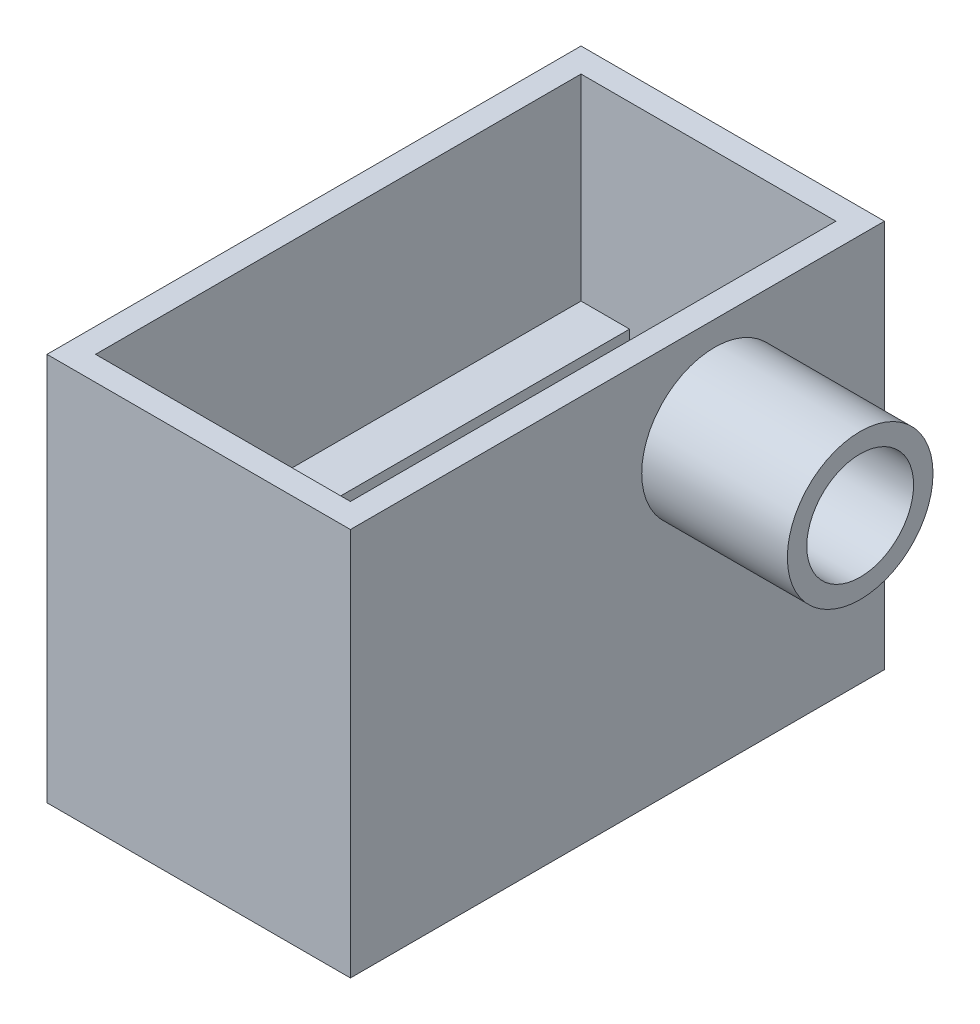
from build123d import *

# Parameters (mm, degrees)
SKETCH1_W                 = 62.5
SKETCH1_H                 = 110
BOSS_EXTRUDE1_DEPTH       = 80
SHELL1_T                  = -5
SHELL1_THICKNESS_2_FACE_W = 100
SHELL1_THICKNESS_2_FACE_H = 52.5
SHELL1_THICKNESS_2_DEPTH  = 6
SKETCH2_R                 = 15
SKETCH2_R_2               = 11
BOSS_EXTRUDE2_DEPTH       = 30
CUT_EXTRUDE2_REACH        = 117.461
BOSS_EXTRUDE3_START       = -52.5
BOSS_EXTRUDE3_DEPTH       = 10
CUT_EXTRUDE4_REACH        = 109.413
SKETCH6_R                 = 14.5
SKETCH6_3_R               = 16.002
SKETCH6_3_R_2             = 14.5
CUT_EXTRUDE5_DEPTH        = 8
SKETCH7_R                 = 4.7625
CUT_EXTRUDE6_DEPTH        = 108.413046228


with BuildPart() as part:
    # Sketch1 → Boss-Extrude1 (new body)
    with BuildSketch(Plane(origin=(0, 0, 0), x_dir=(1, 0, 0), z_dir=(0, 1, 0))):
        Rectangle(SKETCH1_W, SKETCH1_H)
    extrude(amount=BOSS_EXTRUDE1_DEPTH)

    # Shell1
    shell1_openings = [part.faces().sort_by_distance(p)[0] for p in [
        (0, 80, 0),
    ]]
    offset(amount=SHELL1_T, openings=shell1_openings, kind=Kind.INTERSECTION)

    # Shell1 thickness 2 face (on inner face of the shell) → Shell1 thickness 2 (add)
    with BuildSketch(Plane(origin=(0, 5, 0), x_dir=(0, 0, -1), z_dir=(0, -1, 0))):
        Rectangle(SHELL1_THICKNESS_2_FACE_W, SHELL1_THICKNESS_2_FACE_H)
    extrude(amount=-SHELL1_THICKNESS_2_DEPTH)

    # Sketch2 → Boss-Extrude2 (add)
    with BuildSketch(Plane(origin=(31.25, 0, 0), x_dir=(0, 0, -1), z_dir=(1, 0, 0))):
        with Locations(Location((20, 60, 0), (0, 0, 180))):
            Circle(SKETCH2_R)
        with Locations((20, 60)):
            Circle(SKETCH2_R_2, mode=Mode.SUBTRACT)
    extrude(amount=BOSS_EXTRUDE2_DEPTH)

    # Sketch2<3> → Cut-Extrude2 (cut, up to next)
    with BuildSketch(Plane(origin=(31.25, 0, 0), x_dir=(0, 0, -1), z_dir=(1, 0, 0)), mode=Mode.PRIVATE) as cut_extrude2_sk1:
        with BuildLine():
            ThreePointArc((31, 60), (27.778174593, 67.778174593), (20, 71))
            Line((20, 71), (20, 49))
            ThreePointArc((20, 49), (27.778174593, 52.221825407), (31, 60))
        make_face()
    cut_extrude2_tool1 = extrude(cut_extrude2_sk1.sketch, amount=-CUT_EXTRUDE2_REACH, mode=Mode.PRIVATE) & part.part
    # Sketch2<3> → Cut-Extrude2 (cut, up to next)
    with BuildSketch(Plane(origin=(31.25, 0, 0), x_dir=(0, 0, -1), z_dir=(1, 0, 0)), mode=Mode.PRIVATE) as cut_extrude2_sk2:
        with BuildLine():
            Line((20, 49), (20, 71))
            ThreePointArc((20, 71), (9, 60), (20, 49))
        make_face()
    cut_extrude2_tool2 = extrude(cut_extrude2_sk2.sketch, amount=-CUT_EXTRUDE2_REACH, mode=Mode.PRIVATE) & part.part
    # Sketch2<3> → Cut-Extrude2 (cut, up to next)
    with BuildSketch(Plane(origin=(31.25, 0, 0), x_dir=(0, 0, -1), z_dir=(1, 0, 0)), mode=Mode.PRIVATE) as cut_extrude2_sk3:
        with BuildLine():
            ThreePointArc((31, 60), (27.778174593, 67.778174593), (20, 71))
            Line((20, 71), (20, 49))
            ThreePointArc((20, 49), (27.778174593, 52.221825407), (31, 60))
        make_face()
    cut_extrude2_tool3 = extrude(cut_extrude2_sk3.sketch, amount=-CUT_EXTRUDE2_REACH, mode=Mode.PRIVATE) & part.part
    # Sketch2<3> → Cut-Extrude2 (cut, up to next)
    with BuildSketch(Plane(origin=(31.25, 0, 0), x_dir=(0, 0, -1), z_dir=(1, 0, 0)), mode=Mode.PRIVATE) as cut_extrude2_sk4:
        with BuildLine():
            Line((20, 49), (20, 71))
            ThreePointArc((20, 71), (9, 60), (20, 49))
        make_face()
    cut_extrude2_tool4 = extrude(cut_extrude2_sk4.sketch, amount=-CUT_EXTRUDE2_REACH, mode=Mode.PRIVATE) & part.part
    add(cut_extrude2_tool1.solids().sort_by_distance((31.25, 60, -24.668545))[0], mode=Mode.SUBTRACT)
    add(cut_extrude2_tool2.solids().sort_by_distance((31.25, 60, -15.331455))[0], mode=Mode.SUBTRACT)
    add(cut_extrude2_tool3.solids().sort_by_distance((31.25, 60, -24.668545))[0], mode=Mode.SUBTRACT)
    add(cut_extrude2_tool4.solids().sort_by_distance((31.25, 60, -15.331455))[0], mode=Mode.SUBTRACT)

    # 3DSketch1 → Boss-Extrude3 (add)
    with BuildSketch(Plane(origin=(26.25, 39.5, -50), x_dir=(0, -0.04993761694389221, 0.9987523388778448), z_dir=(1, 0, 0)).offset(BOSS_EXTRUDE3_START)):
        Polygon((0, 0), (0.249688085, 4.993761694), (100.124921973, 0), (99.875233888, -4.993761694), align=None)
    extrude(amount=BOSS_EXTRUDE3_DEPTH)

    # Sketch6 → Cut-Extrude4 (cut, up to next)
    with BuildSketch(Plane(origin=(0, 11, 0), x_dir=(1, 0, 0), z_dir=(0, 1, 0)), mode=Mode.PRIVATE) as cut_extrude4_sk1:
        with Locations(Location((2.75, -1, 0), (0, 0, 270))):
            Circle(SKETCH6_R)
    cut_extrude4_tool1 = extrude(cut_extrude4_sk1.sketch, amount=-CUT_EXTRUDE4_REACH, mode=Mode.PRIVATE) & part.part
    add(cut_extrude4_tool1.solids().sort_by_distance((2.75, 11, 1))[0], mode=Mode.SUBTRACT)

    # Sketch6<3> → Cut-Extrude5 (cut)
    with BuildSketch(Plane(origin=(0, 11, 0), x_dir=(1, 0, 0), z_dir=(0, 1, 0))):
        with Locations(Location((2.75, -1, 0), (0, 0, 270))):
            Circle(SKETCH6_3_R)
        with Locations(Location((2.75, -1, 0), (0, 0, 270))):
            Circle(SKETCH6_3_R_2, mode=Mode.SUBTRACT)
    extrude(amount=-CUT_EXTRUDE5_DEPTH, mode=Mode.SUBTRACT)

    # Sketch7 → Cut-Extrude6 (cut, through all)
    with BuildSketch(Plane(origin=(0, 11, 0), x_dir=(1, 0, 0), z_dir=(0, 1, 0))):
        with Locations(Location((2.75, -36, 0), (0, 0, 270))):
            Circle(SKETCH7_R)
        with Locations(Location((2.75, 34, 0), (0, 0, 270))):
            Circle(SKETCH7_R)
    extrude(amount=-CUT_EXTRUDE6_DEPTH, mode=Mode.SUBTRACT)


solid = part.part
